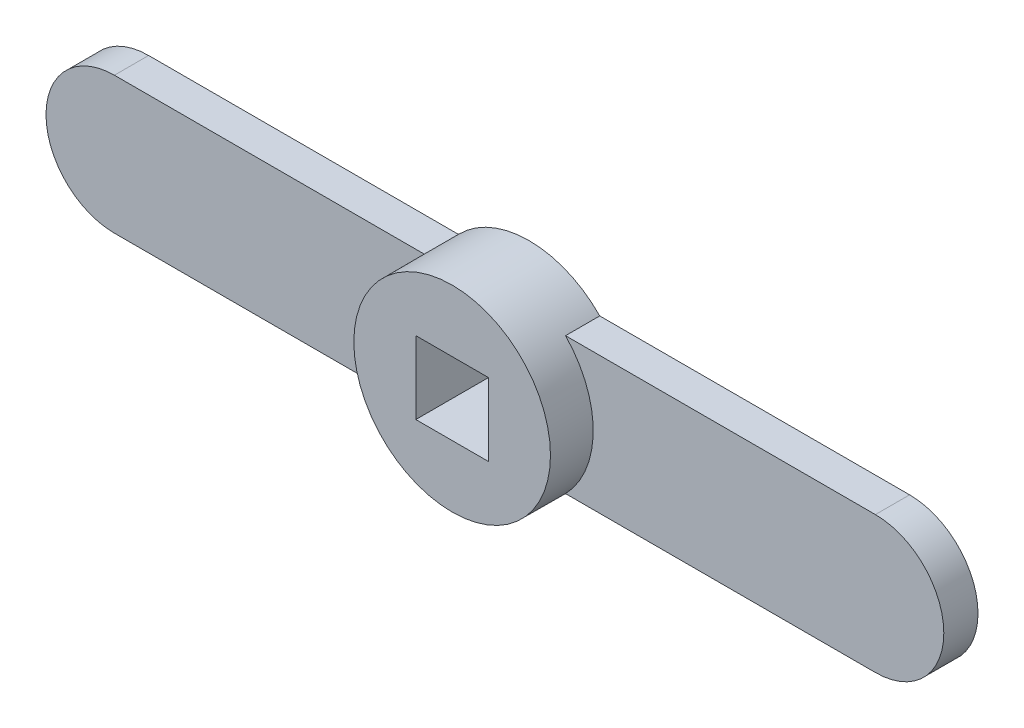
from build123d import *

# Parameters (mm, degrees)
EXTRUDE_1_DEPTH     = 4
SKETCH_2_R          = 11.5
EXTRUDE_2_DEPTH     = 9
SKETCH_3_W          = 8.5
SKETCH_3_H          = 8.5
CUT_EXTRUDE_1_DEPTH = 55.493118832


with BuildPart() as part:
    # Эскиз1 → Бобышка-Вытянуть1 (new body)
    with BuildSketch(Plane.XY):
        with BuildLine():
            Line((-44.5, 8), (44.5, 8))
            ThreePointArc((44.5, 8), (52.5, 0), (44.5, -8))
            Line((44.5, -8), (-44.5, -8))
            ThreePointArc((-44.5, -8), (-52.5, 0), (-44.5, 8))
        make_face()
    extrude(amount=EXTRUDE_1_DEPTH)

    # Эскиз2 → Бобышка-Вытянуть2 (add)
    with BuildSketch(Plane(origin=(0, 0, 0), x_dir=(-1, 0, 0), z_dir=(0, 0, -1))):
        Circle(SKETCH_2_R)
    extrude(amount=-EXTRUDE_2_DEPTH)

    # Эскиз3 → Вырез-Вытянуть1 (cut, through all)
    with BuildSketch(Plane(origin=(0, 0, 0), x_dir=(-1, 0, 0), z_dir=(0, 0, -1))):
        Rectangle(SKETCH_3_W, SKETCH_3_H)
    extrude(amount=-CUT_EXTRUDE_1_DEPTH, mode=Mode.SUBTRACT)


solid = part.part
